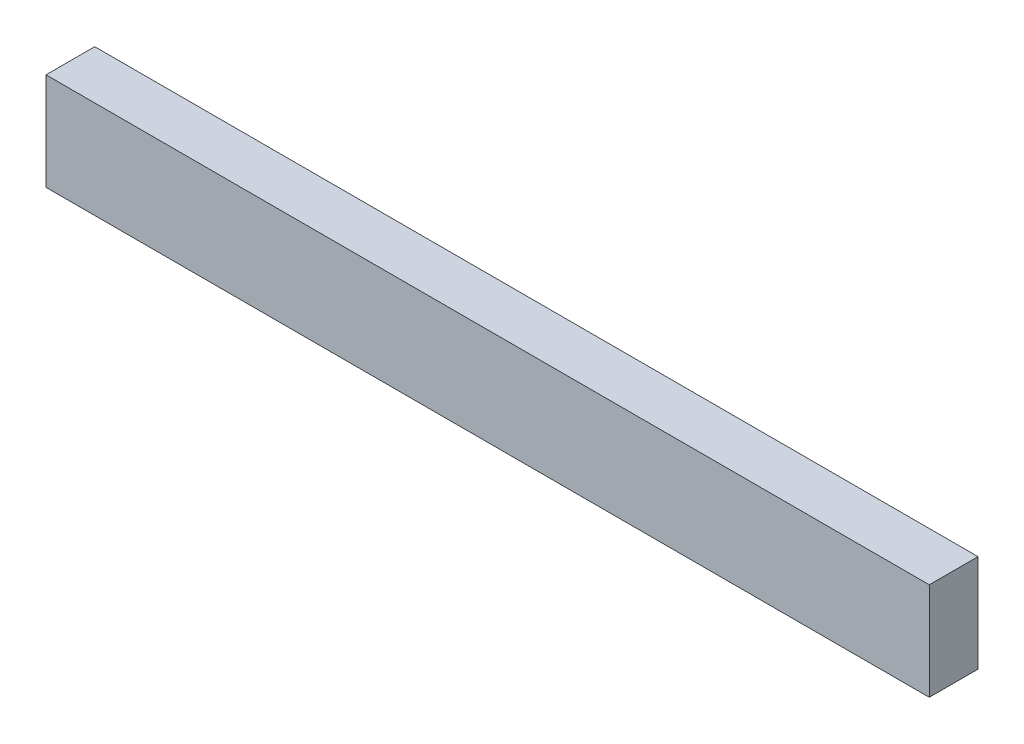
from build123d import *

# Parameters (mm, degrees)
ESQUISSE1_W        = 435
ESQUISSE1_H        = 48
BOSS_EXTRU_1_DEPTH = 12


with BuildPart() as part:
    # Esquisse1 → Boss.-Extru.1 (new, symmetric)
    with BuildSketch(Plane.XY):
        Rectangle(ESQUISSE1_W, ESQUISSE1_H)
    extrude(amount=BOSS_EXTRU_1_DEPTH, both=True)


solid = part.part
